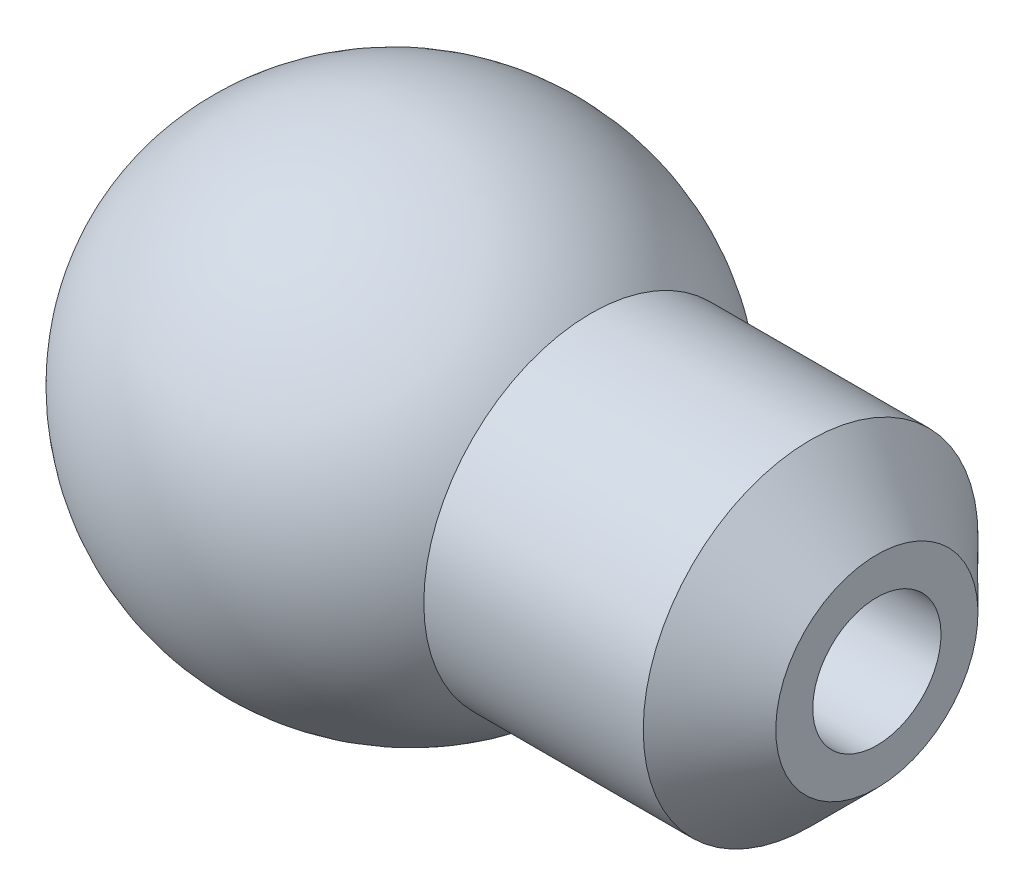
from build123d import *


with BuildPart() as part:
    # Sketch1 → Revolve1 (revolve)
    with BuildSketch(Plane.XY, mode=Mode.PRIVATE) as revolve1_sk:
        with BuildLine():
            Line((0, 26), (60, 26))
            Line((60, 26), (60, 41))
            Line((60, 41), (33.129942315, 67.870057685))
            Line((33.129942315, 67.870057685), (-55.850057685, 67.870057685))
            ThreePointArc((-55.850057685, 67.870057685), (-169.745893523, 93.14097487), (-240, 0))
            Line((-240, 0), (0, 0))
            Line((0, 0), (0, 26))
        make_face()
    revolve(revolve1_sk.sketch.rotate(Axis((-240, 0, 0), (1, 0, 0)), 180), axis=Axis((-240, 0, 0), (1, 0, 0)))


solid = part.part
